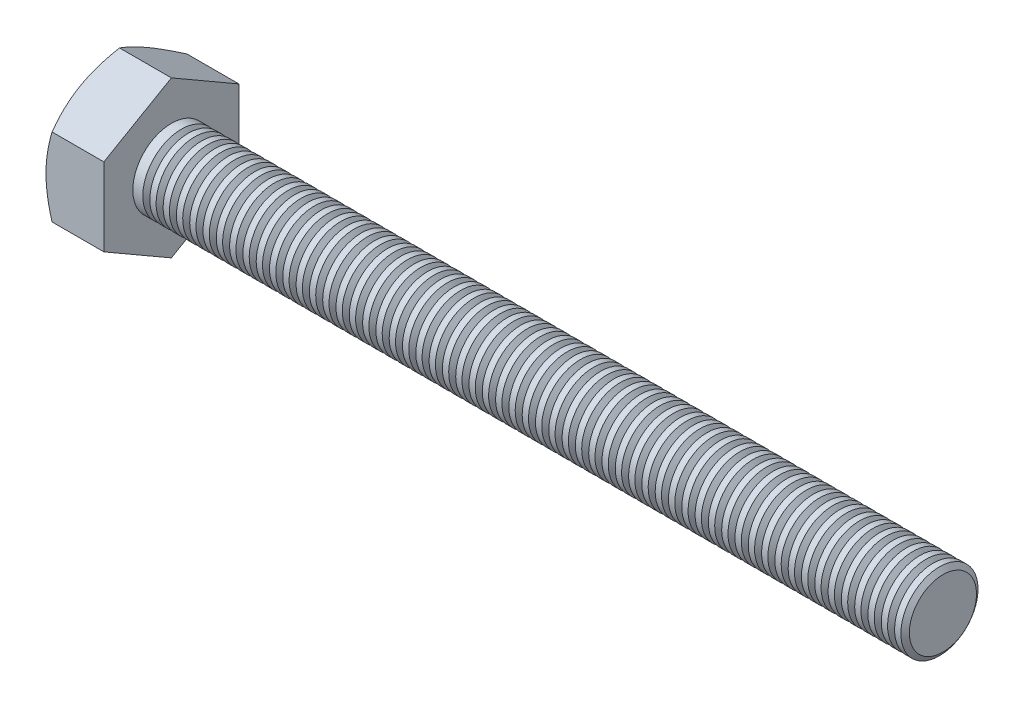
from build123d import *

# Parameters (mm, degrees)
SKETCH2_R       = 4.081986143
HEX_DIE_DEPTH   = 3
SKETCH4_R       = 3.0625
INDENT_DEPTH    = 0.375
THDSCHPAT_COUNT = 58
THDSCHPAT_PITCH = 0.689473684


with BuildPart() as part:
    # BodySke → Base-Revolve (revolve)
    with BuildSketch(Plane.XY, mode=Mode.PRIVATE) as base_revolve_sk:
        Polygon((3, 2), (3, 4.041570439), (0.312675839, 4.041570439), (0, 3.5), (0, 0), (43, 0), (43, 2), align=None)
    revolve(base_revolve_sk.sketch.rotate(Axis((-25.4, 0, 0), (1, 0, 0)), 90), axis=Axis((-25.4, 0, 0), (1, 0, 0)))

    # Sketch2 → Hex-Die (cut)
    with BuildSketch(Plane(origin=(0, 0, 0), x_dir=(0, 0, -1), z_dir=(1, 0, 0))):
        Circle(SKETCH2_R)
        Polygon((-3.5, 2.020725951), (0, 4.041451902), (3.5, 2.020725951), (3.5, -2.020725951), (0, -4.041451902), (-3.5, -2.020725951), align=None, mode=Mode.SUBTRACT)
    extrude(amount=HEX_DIE_DEPTH, mode=Mode.SUBTRACT)

    # Sketch4 → Indent (cut)
    with BuildSketch(Plane(origin=(0, 0, 0), x_dir=(0, 0, -1), z_dir=(1, 0, 0))):
        Circle(SKETCH4_R)
    extrude(amount=INDENT_DEPTH, mode=Mode.SUBTRACT)

    # ThdSchSke → ThreadSchematic (revolve, cut)
    with BuildSketch(Plane.XY, mode=Mode.PRIVATE) as threadschematic_sk:
        Polygon((3.7, -1.74075851), (3.50191906, -2.023647409), (3.50191906, -4.925), (3.89808094, -4.925), (3.89808094, -2.023647409), align=None)
    threadschematic = revolve(threadschematic_sk.sketch.rotate(Axis((-3.175, 0, 0), (1, 0, 0)), 270), axis=Axis((-3.175, 0, 0), (1, 0, 0)), mode=Mode.SUBTRACT)

    # ThdSchPat: ThreadSchematic ×58
    with Locations(*[(i * THDSCHPAT_PITCH, 0, 0) for i in range(1, THDSCHPAT_COUNT)]):
        add(threadschematic, mode=Mode.SUBTRACT)


solid = part.part
